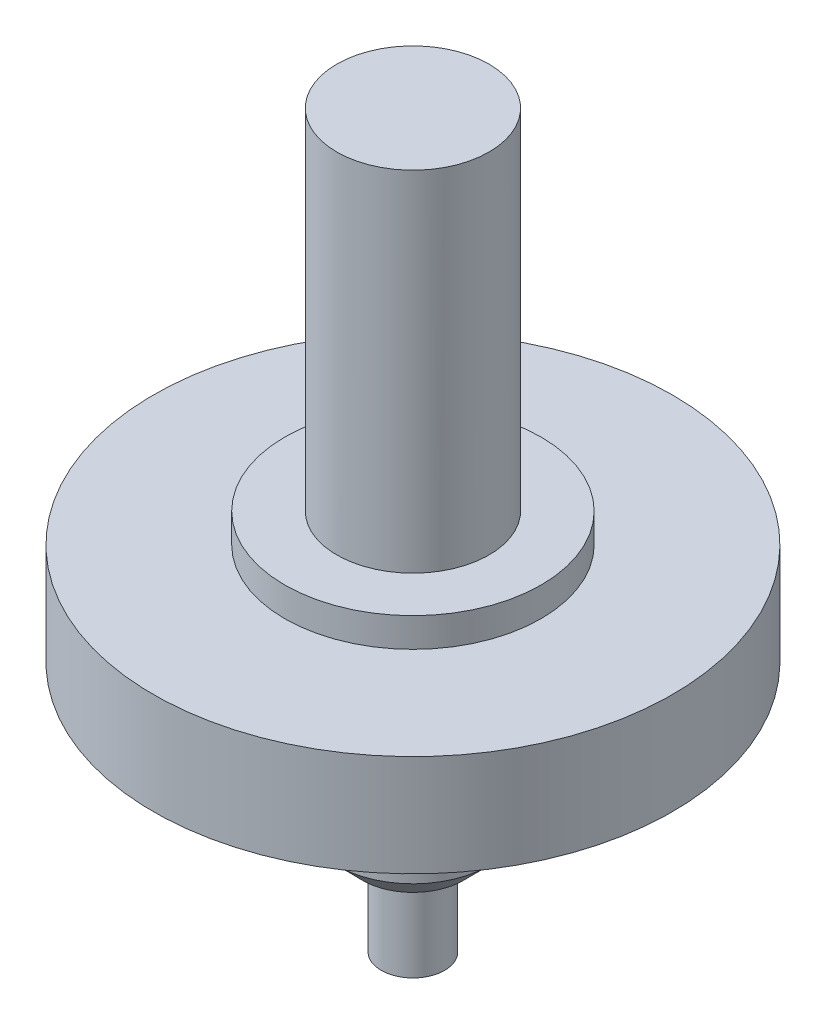
from build123d import *

# Parameters (mm, degrees)
CUT_EXTRUDE_START   = -12
CUT_EXTRUDE_1_DEPTH = 12
CUT_EXTRUDE_START_2 = -13.5
SKETCH_3_R          = 3
CUT_EXTRUDE_2_DEPTH = 13.5


with BuildPart() as part:
    # ｽｹｯﾁ1 → 回転1 (revolve)
    with BuildSketch(Plane.XY, mode=Mode.PRIVATE) as revolve_1_sk:
        Polygon((0, 0), (0, 42.3), (3, 42.3), (3, 15.05), (5.05, 15.05), (5.05, 13.9), (10.225, 13.9), (10.225, 9.9), (3, 9.9), (3, 4.45), (2, 3.45), (1.25, 3.45), (1.25, 0), align=None)
    revolve(revolve_1_sk.sketch.rotate(Axis((0, 0, 0), (0, 1, 0)), 90), axis=Axis((0, 0, 0), (0, 1, 0)))

    # ｽｹｯﾁ2 → ｶｯﾄ - 押し出し1 (cut)
    with BuildSketch(Plane(origin=(0, 42.3, 0), x_dir=(1, 0, 0), z_dir=(0, 1, 0)).offset(CUT_EXTRUDE_START)):
        with BuildLine():
            Line((-1.658312395, 2.5), (1.658312395, 2.5))
            ThreePointArc((1.658312395, 2.5), (0, 3), (-1.658312395, 2.5))
        make_face()
    extrude(amount=CUT_EXTRUDE_1_DEPTH, mode=Mode.SUBTRACT)

    # ｽｹｯﾁ3 → ｶｯﾄ - 押し出し2 (cut)
    with BuildSketch(Plane(origin=(0, 42.3, 0), x_dir=(1, 0, 0), z_dir=(0, 1, 0)).offset(CUT_EXTRUDE_START_2)):
        with Locations(Location((0, 0, 0), (0, 0, 90))):
            Circle(SKETCH_3_R)
    extrude(amount=CUT_EXTRUDE_2_DEPTH, mode=Mode.SUBTRACT)


solid = part.part
